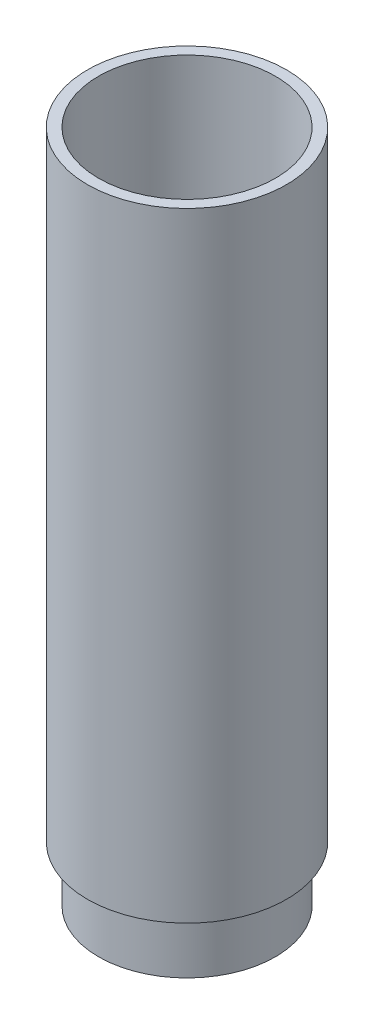
from build123d import *

# Parameters (mm, degrees)
SKETCH1_R               = 8
SKETCH1_R_2             = 7
BOSS_EXTRUDE1_DEPTH     = 15
SKETCH2_R               = 9
SKETCH2_R_2             = 8
BOSS_EXTRUDE2_DEPTH     = 120
SKETCH3_R               = 8
SKETCH3_R_2             = 7
CUT_EXTRUDE1_DEPTH      = 5
CUT_EXTRUDE2_DEPTH      = 31
CUT_EXTRUDE2_DEPTH_BACK = 31
SKETCH4_W               = 18
SKETCH4_H               = 40.940584593
CUT_EXTRUDE3_DEPTH      = 31
CUT_EXTRUDE3_DEPTH_BACK = 31
SKETCH5_W               = 18
SKETCH5_H               = 23.079337433


with BuildPart() as part:
    # Sketch1 → Boss-Extrude1 (new body)
    with BuildSketch(Plane(origin=(0, 0, 0), x_dir=(1, 0, 0), z_dir=(0, 1, 0))):
        Circle(SKETCH1_R)
        Circle(SKETCH1_R_2, mode=Mode.SUBTRACT)
    extrude(amount=BOSS_EXTRUDE1_DEPTH)

    # Sketch2 → Boss-Extrude2 (add)
    with BuildSketch(Plane(origin=(0, 10, 0), x_dir=(1, 0, 0), z_dir=(0, 1, 0))):
        Circle(SKETCH2_R)
        Circle(SKETCH2_R_2, mode=Mode.SUBTRACT)
    extrude(amount=BOSS_EXTRUDE2_DEPTH)

    # Sketch3 → Cut-Extrude1 (cut)
    with BuildSketch(Plane(origin=(0, 0, 0), x_dir=(1, 0, 0), z_dir=(0, 1, 0))):
        Circle(SKETCH3_R)
        Circle(SKETCH3_R_2, mode=Mode.SUBTRACT)
    extrude(amount=CUT_EXTRUDE1_DEPTH, mode=Mode.SUBTRACT)

    # Sketch4 → Cut-Extrude2 (cut, two sides: drawn at the far end of the back side and taken through both)
    with BuildSketch(Plane.XY.offset(-CUT_EXTRUDE2_DEPTH_BACK)):
        with Locations((0, 109.529707704)):
            Rectangle(SKETCH4_W, SKETCH4_H)
    extrude(amount=CUT_EXTRUDE2_DEPTH + CUT_EXTRUDE2_DEPTH_BACK, mode=Mode.SUBTRACT)

    # Sketch5 → Cut-Extrude3 (cut, two sides: drawn at the far end of the back side and taken through both)
    with BuildSketch(Plane.XY.offset(-CUT_EXTRUDE3_DEPTH_BACK)):
        with Locations((0, 77.51974669)):
            Rectangle(SKETCH5_W, SKETCH5_H)
    extrude(amount=CUT_EXTRUDE3_DEPTH + CUT_EXTRUDE3_DEPTH_BACK, mode=Mode.SUBTRACT)


solid = part.part
